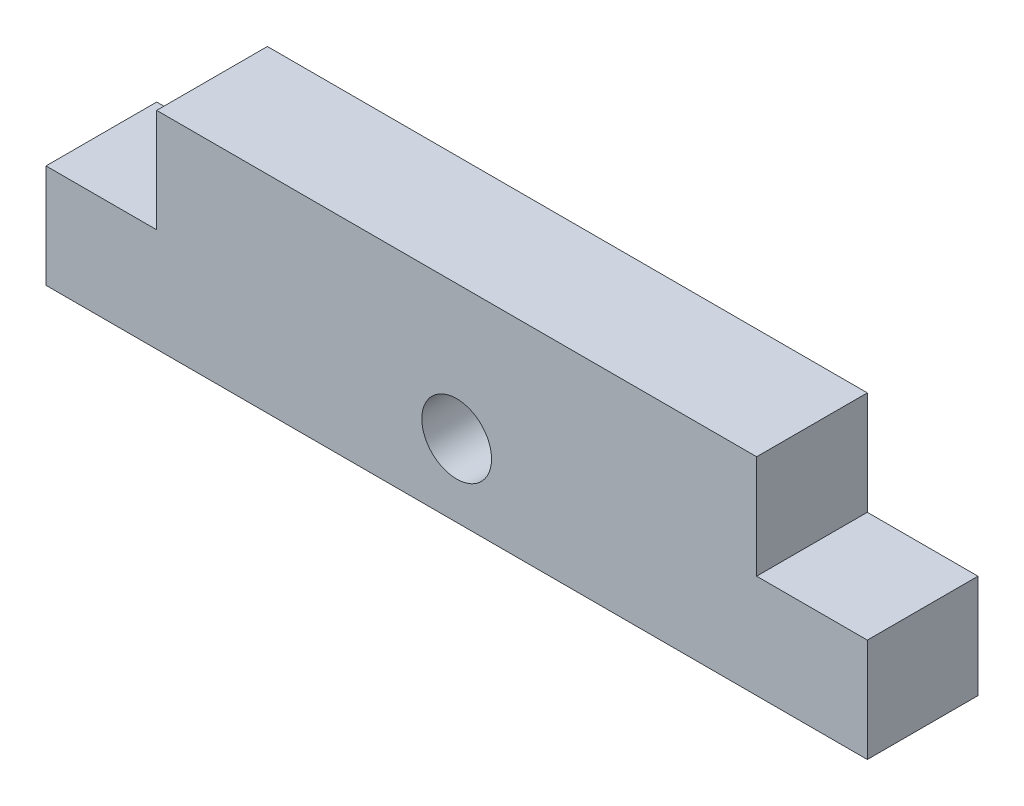
from build123d import *

# Parameters (mm, degrees)
MODEL_R             = 1.685
BOSS_EXTRUDE1_DEPTH = 5.35


with BuildPart() as part:
    # Model → Boss-Extrude1 (new body)
    with BuildSketch(Plane.XY):
        Polygon((5.350000225, 9.999999777), (5.350000225, 4.999999888), (0, 4.999999888), (0, 0), (39.700001478, 0), (39.700001478, 4.999999888), (34.350000322, 4.999999888), (34.350000322, 9.999999777), align=None)
        with Locations((19.85, 3.5)):
            Circle(MODEL_R, mode=Mode.SUBTRACT)
    extrude(amount=BOSS_EXTRUDE1_DEPTH)


solid = part.part
